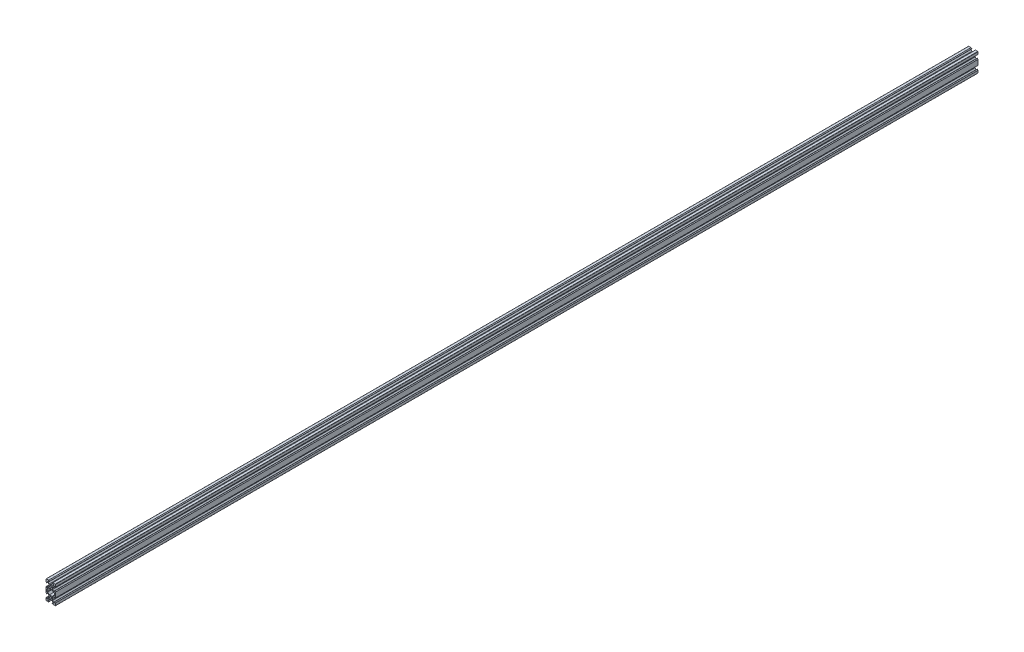
from build123d import *

# Parameters (mm, degrees)
SKETCH1_R           = 2.1
BOSS_EXTRUDE1_DEPTH = 980


with BuildPart() as part:
    # Sketch1 → Boss-Extrude1 (new, symmetric)
    with BuildSketch(Plane.XY):
        with BuildLine():
            Line((4.58, -20), (9.5, -20))
            ThreePointArc((9.5, -20), (9.853553391, -19.853553391), (10, -19.5))
            Line((10, -19.5), (10, -14.58))
            Line((10, -14.58), (8.545, -13.125))
            Line((8.545, -13.125), (8.2, -13.125))
            Line((8.2, -13.125), (8.2, -15.5))
            Line((8.2, -15.5), (6.560660172, -15.5))
            Line((6.560660172, -15.5), (3.9, -12.839339828))
            Line((3.9, -12.839339828), (3.9, -10.21))
            Line((3.9, -10.21), (3.69, -10))
            Line((3.69, -10), (3.9, -9.79))
            Line((3.9, -9.79), (3.9, -7.160660172))
            Line((3.9, -7.160660172), (6.560660172, -4.5))
            Line((6.560660172, -4.5), (8.2, -4.5))
            Line((8.2, -4.5), (8.2, -6.875))
            Line((8.2, -6.875), (8.545, -6.875))
            Line((8.545, -6.875), (10, -5.42))
            Line((10, -5.42), (10, 5.42))
            Line((10, 5.42), (8.545, 6.875))
            Line((8.545, 6.875), (8.2, 6.875))
            Line((8.2, 6.875), (8.2, 4.5))
            Line((8.2, 4.5), (6.560660172, 4.5))
            Line((6.560660172, 4.5), (3.9, 7.160660172))
            Line((3.9, 7.160660172), (3.9, 9.79))
            Line((3.9, 9.79), (3.69, 10))
            Line((3.69, 10), (3.9, 10.21))
            Line((3.9, 10.21), (3.9, 12.839339828))
            Line((3.9, 12.839339828), (6.560660172, 15.5))
            Line((6.560660172, 15.5), (8.2, 15.5))
            Line((8.2, 15.5), (8.2, 13.125))
            Line((8.2, 13.125), (8.545, 13.125))
            Line((8.545, 13.125), (10, 14.58))
            Line((10, 14.58), (10, 19.5))
            ThreePointArc((10, 19.5), (9.853553391, 19.853553391), (9.5, 20))
            Line((9.5, 20), (4.58, 20))
            Line((4.58, 20), (3.125, 18.545))
            Line((3.125, 18.545), (3.125, 18.2))
            Line((3.125, 18.2), (5.5, 18.2))
            Line((5.5, 18.2), (5.5, 16.560660172))
            Line((5.5, 16.560660172), (2.839339828, 13.9))
            Line((2.839339828, 13.9), (0.21, 13.9))
            Line((0.21, 13.9), (0, 13.69))
            Line((0, 13.69), (-0.21, 13.9))
            Line((-0.21, 13.9), (-2.839339828, 13.9))
            Line((-2.839339828, 13.9), (-5.5, 16.560660172))
            Line((-5.5, 16.560660172), (-5.5, 18.2))
            Line((-5.5, 18.2), (-3.125, 18.2))
            Line((-3.125, 18.2), (-3.125, 18.545))
            Line((-3.125, 18.545), (-4.58, 20))
            Line((-4.58, 20), (-9.5, 20))
            ThreePointArc((-9.5, 20), (-9.853553391, 19.853553391), (-10, 19.5))
            Line((-10, 19.5), (-10, 14.58))
            Line((-10, 14.58), (-8.545, 13.125))
            Line((-8.545, 13.125), (-8.2, 13.125))
            Line((-8.2, 13.125), (-8.2, 15.5))
            Line((-8.2, 15.5), (-6.560660172, 15.5))
            Line((-6.560660172, 15.5), (-3.9, 12.839339828))
            Line((-3.9, 12.839339828), (-3.9, 10.21))
            Line((-3.9, 10.21), (-3.69, 10))
            Line((-3.69, 10), (-3.9, 9.79))
            Line((-3.9, 9.79), (-3.9, 7.160660172))
            Line((-3.9, 7.160660172), (-6.560660172, 4.5))
            Line((-6.560660172, 4.5), (-8.2, 4.5))
            Line((-8.2, 4.5), (-8.2, 6.875))
            Line((-8.2, 6.875), (-8.545, 6.875))
            Line((-8.545, 6.875), (-10, 5.42))
            Line((-10, 5.42), (-10, -5.42))
            Line((-10, -5.42), (-8.545, -6.875))
            Line((-8.545, -6.875), (-8.2, -6.875))
            Line((-8.2, -6.875), (-8.2, -4.5))
            Line((-8.2, -4.5), (-6.560660172, -4.5))
            Line((-6.560660172, -4.5), (-3.9, -7.160660172))
            Line((-3.9, -7.160660172), (-3.9, -9.79))
            Line((-3.9, -9.79), (-3.69, -10))
            Line((-3.69, -10), (-3.9, -10.21))
            Line((-3.9, -10.21), (-3.9, -12.839339828))
            Line((-3.9, -12.839339828), (-6.560660172, -15.5))
            Line((-6.560660172, -15.5), (-8.2, -15.5))
            Line((-8.2, -15.5), (-8.2, -13.125))
            Line((-8.2, -13.125), (-8.545, -13.125))
            Line((-8.545, -13.125), (-10, -14.58))
            Line((-10, -14.58), (-10, -19.5))
            ThreePointArc((-10, -19.5), (-9.853553391, -19.853553391), (-9.5, -20))
            Line((-9.5, -20), (-4.58, -20))
            Line((-4.58, -20), (-3.125, -18.545))
            Line((-3.125, -18.545), (-3.125, -18.2))
            Line((-3.125, -18.2), (-5.5, -18.2))
            Line((-5.5, -18.2), (-5.5, -16.560660172))
            Line((-5.5, -16.560660172), (-2.839339828, -13.9))
            Line((-2.839339828, -13.9), (-0.21, -13.9))
            Line((-0.21, -13.9), (0, -13.69))
            Line((0, -13.69), (0.21, -13.9))
            Line((0.21, -13.9), (2.839339828, -13.9))
            Line((2.839339828, -13.9), (5.5, -16.560660172))
            Line((5.5, -16.560660172), (5.5, -18.2))
            Line((5.5, -18.2), (3.125, -18.2))
            Line((3.125, -18.2), (3.125, -18.545))
            Line((3.125, -18.545), (4.58, -20))
        make_face()
        with Locations((0, -10)):
            Circle(SKETCH1_R, mode=Mode.SUBTRACT)
        Polygon((-6.239339828, -2.7), (-8.2, -2.7), (-8.2, 2.7), (-6.239339828, 2.7), (-2.839339828, 6.1), (2.839339828, 6.1), (6.239339828, 2.7), (8.2, 2.7), (8.2, -2.7), (6.239339828, -2.7), (2.839339828, -6.1), (-2.839339828, -6.1), align=None, mode=Mode.SUBTRACT)
        with Locations((0, 10)):
            Circle(SKETCH1_R, mode=Mode.SUBTRACT)
    extrude(amount=BOSS_EXTRUDE1_DEPTH, both=True)


solid = part.part
